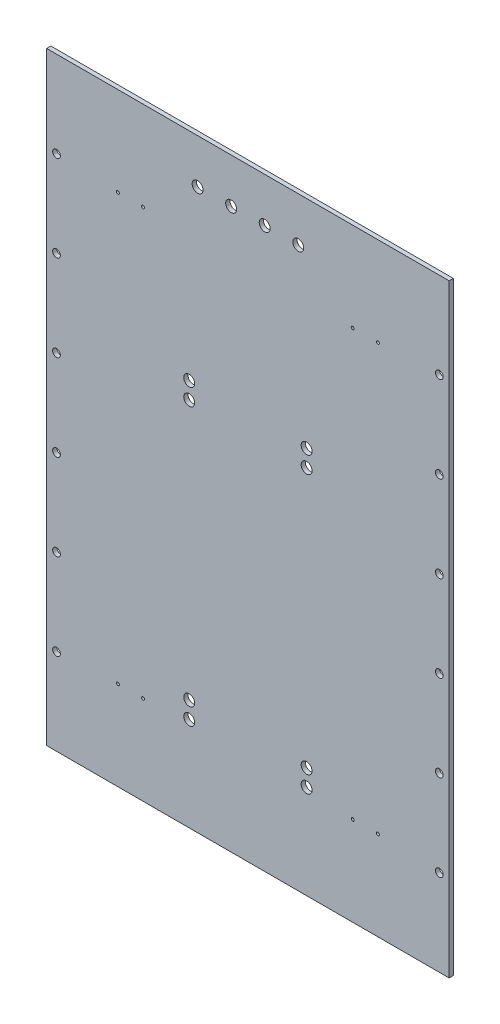
from build123d import *

# Parameters (mm, degrees)
SKETCH1_W               = 609.6
SKETCH1_H               = 914.4
BOSS_EXTRUDE1_DEPTH     = 3.175
F_8_CLEARANCE_HOLE1_D   = 4.4958
CUT_EXTRUDE1_DEPTH      = 550.522704263
CUT_EXTRUDE1_DEPTH_BACK = 550.522704263
SKETCH4_R               = 8.27024
F_3_8_CLEARANCE_HOLE1_D = 11.684


with BuildPart() as part:
    # Sketch1 → Boss-Extrude1 (new, symmetric)
    with BuildSketch(Plane.XY):
        Rectangle(SKETCH1_W, SKETCH1_H)
    extrude(amount=BOSS_EXTRUDE1_DEPTH, both=True)

    # #8 Clearance Hole1 (through all)
    with Locations(Plane.XY.offset(3.175)):
        with Locations((-196.85, -322.2625), (-158.75, -322.2625), (196.85, -322.2625), (158.75, -322.2625), (158.75, 322.2625), (196.85, 322.2625), (-158.75, 322.2625), (-196.85, 322.2625)):
            Hole(F_8_CLEARANCE_HOLE1_D / 2)

    # Sketch4 → Cut-Extrude1 (cut, two sides: drawn at the far end of the back side and taken through both)
    with BuildSketch(Plane.XY.offset(3.175).offset(-CUT_EXTRUDE1_DEPTH_BACK)):
        with Locations((76.2, 389.892639343)):
            Circle(SKETCH4_R)
        with Locations((-25.4, 389.892639343)):
            Circle(SKETCH4_R)
        with Locations((25.4, 389.892639343)):
            Circle(SKETCH4_R)
        with Locations((-76.2, 389.892639343)):
            Circle(SKETCH4_R)
        with Locations((-88.9, 129.542639343)):
            Circle(SKETCH4_R)
        with Locations((-88.9, 104.142639343)):
            Circle(SKETCH4_R)
        with Locations((-88.9, -289.557360657)):
            Circle(SKETCH4_R)
        with Locations((-88.9, -314.957360657)):
            Circle(SKETCH4_R)
        with Locations(Location((88.9, -314.957360657, 0), (0, 0, 180))):
            Circle(SKETCH4_R)
        with Locations(Location((88.9, -289.557360657, 0), (0, 0, 180))):
            Circle(SKETCH4_R)
        with Locations(Location((88.9, 104.142639343, 0), (0, 0, 180))):
            Circle(SKETCH4_R)
        with Locations(Location((88.9, 129.542639343, 0), (0, 0, 180))):
            Circle(SKETCH4_R)
    extrude(amount=CUT_EXTRUDE1_DEPTH + CUT_EXTRUDE1_DEPTH_BACK, mode=Mode.SUBTRACT)

    # 3/8 Clearance Hole1 (through all)
    with Locations(Plane.XY.offset(3.175)):
        with Locations((-289.8775, -326.571428571), (-289.8775, -195.942857215), (-289.8775, -65.314285859), (-289.8775, 65.314285497), (-289.8775, 195.942856853), (-289.8775, 326.571428209), (289.8775, 326.571428209), (289.8775, 195.942856853), (289.8775, 65.314285497), (289.8775, -65.314285859), (289.8775, -195.942857215), (289.8775, -326.571428571)):
            Hole(F_3_8_CLEARANCE_HOLE1_D / 2)


solid = part.part
